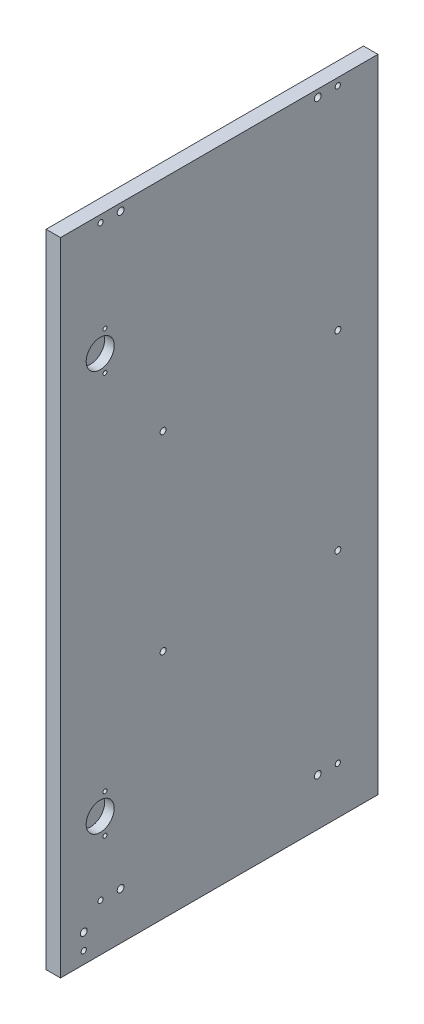
from build123d import *

# Parameters (mm, degrees)
SKETCH1_W                      = 18
SKETCH1_H                      = 396
LEFT_HAND_END_DEPTH            = 800
SKETCH3_R                      = 3.75
SHELF_MOUNT_HOLES_DEPTH        = 8
SKETCH2_R                      = 3.25
SKETCH2_R_2                    = 4.25
BASE_AND_TOP_MOUNT_HOLES_DEPTH = 12
SKETCH4_R                      = 17.5
SKETCH4_R_2                    = 2.5
HINGE_HOLES_DEPTH              = 12


with BuildPart() as part:
    # Sketch1 → Left Hand End (new body)
    with BuildSketch(Plane(origin=(0, -800, 0), x_dir=(-1, 0, 0), z_dir=(0, 1, 0))):
        with Locations((9, -198)):
            Rectangle(SKETCH1_W, SKETCH1_H)
    extrude(amount=LEFT_HAND_END_DEPTH)

    # Sketch3 → Shelf Mount Holes (cut)
    with BuildSketch(Plane(origin=(0, 0, 0), x_dir=(0, 0, -1), z_dir=(1, 0, 0))):
        with Locations((128, -511)):
            Circle(SKETCH3_R)
        with Locations((346, -511)):
            Circle(SKETCH3_R)
        with Locations((346, -273)):
            Circle(SKETCH3_R)
        with Locations((128, -273)):
            Circle(SKETCH3_R)
    extrude(amount=-SHELF_MOUNT_HOLES_DEPTH, mode=Mode.SUBTRACT)

    # Sketch2 → Base and Top Mount Holes (cut)
    with BuildSketch(Plane(origin=(0, 0, 0), x_dir=(0, 0, -1), z_dir=(1, 0, 0))):
        with Locations((50, -9)):
            Circle(SKETCH2_R)
        with Locations((346, -9)):
            Circle(SKETCH2_R)
        with Locations((75, -9)):
            Circle(SKETCH2_R_2)
        with Locations((321, -9)):
            Circle(SKETCH2_R_2)
        with Locations((50, -741)):
            Circle(SKETCH2_R)
        with Locations((75, -741)):
            Circle(SKETCH2_R_2)
        with Locations((321, -741)):
            Circle(SKETCH2_R_2)
        with Locations((346, -741)):
            Circle(SKETCH2_R)
        with Locations((29, -765)):
            Circle(SKETCH2_R_2)
        with Locations((29, -785)):
            Circle(SKETCH2_R)
    extrude(amount=-BASE_AND_TOP_MOUNT_HOLES_DEPTH, mode=Mode.SUBTRACT)

    # Sketch4 → Hinge Holes (cut)
    with BuildSketch(Plane(origin=(0, 0, 0), x_dir=(0, 0, -1), z_dir=(1, 0, 0))):
        with Locations((49.5, -650)):
            Circle(SKETCH4_R)
        with Locations((55.5, -626)):
            Circle(SKETCH4_R_2)
        with Locations((55.5, -674)):
            Circle(SKETCH4_R_2)
        with Locations((49.5, -150)):
            Circle(SKETCH4_R)
        with Locations((55.5, -126)):
            Circle(SKETCH4_R_2)
        with Locations((55.5, -174)):
            Circle(SKETCH4_R_2)
    extrude(amount=-HINGE_HOLES_DEPTH, mode=Mode.SUBTRACT)


solid = part.part
